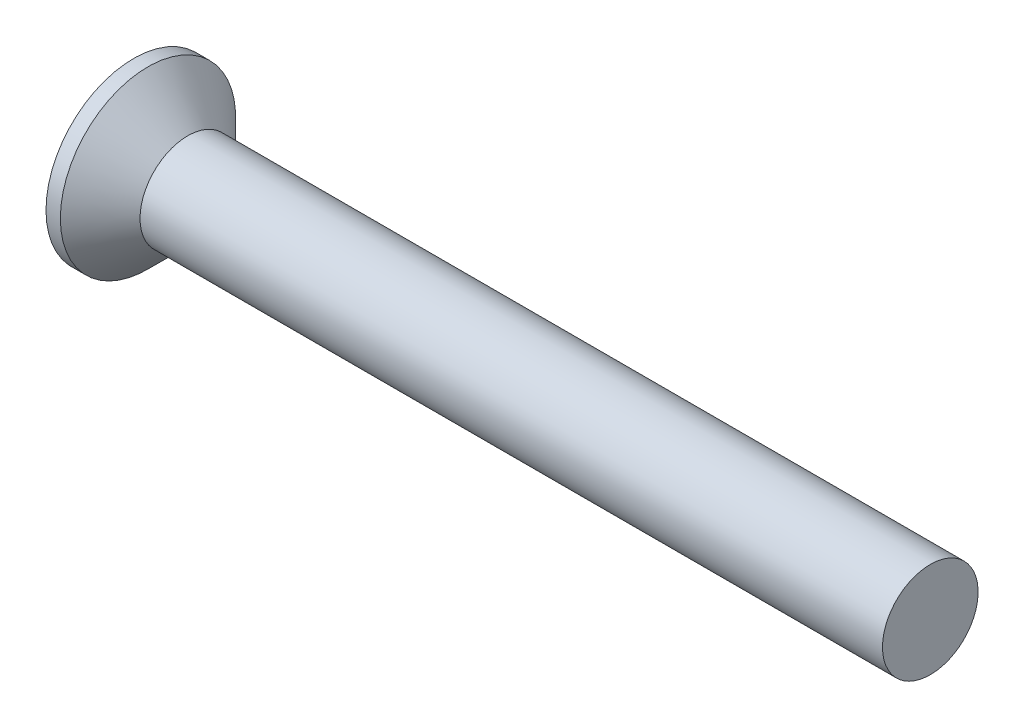
from build123d import *

# Parameters (mm, degrees)
CIRPATTERN1_COUNT = 2
CIRPATTERN1_ANGLE = 90


with BuildPart() as part:
    # BodySke → Base-Revolve (revolve)
    with BuildSketch(Plane.XY, mode=Mode.PRIVATE) as base_revolve_sk:
        Polygon((0, 0), (0, 2.75), (0.45, 2.75), (1.7, 1.5), (25, 1.5), (25, 0), align=None)
    revolve(base_revolve_sk.sketch.rotate(Axis((-6.35, 0, 0), (1, 0, 0)), 90), axis=Axis((-6.35, 0, 0), (1, 0, 0)))

    # Sketch3 → Cross section 0
    with BuildSketch(Plane.ZY):
        with BuildLine():
            Line((-0.395, 1.55), (0.395, 1.55))
            Line((0.395, 1.55), (0.395, -1.55))
            Line((0.395, -1.55), (-0.395, -1.55))
            Line((-0.395, -1.55), (-0.395, 1.55))
        make_face()
    # Sketch4 → Cross section 1
    with BuildSketch(Plane.ZY.offset(-2.08)):
        with BuildLine():
            Line((-0.1975, 0.1975), (0.1975, 0.1975))
            Line((0.1975, 0.1975), (0.1975, -0.1975))
            Line((0.1975, -0.1975), (-0.1975, -0.1975))
            Line((-0.1975, -0.1975), (-0.1975, 0.1975))
        make_face()
    cross = loft(mode=Mode.SUBTRACT)

    # CirPattern1: Cross ×2 about axis
    cirpattern1_axis = Axis((0, 0, 0), (1, 0, 0))
    for i in range(1, CIRPATTERN1_COUNT):
        add(cross.rotate(cirpattern1_axis, i * CIRPATTERN1_ANGLE / (CIRPATTERN1_COUNT - 1)), mode=Mode.SUBTRACT)


solid = part.part
